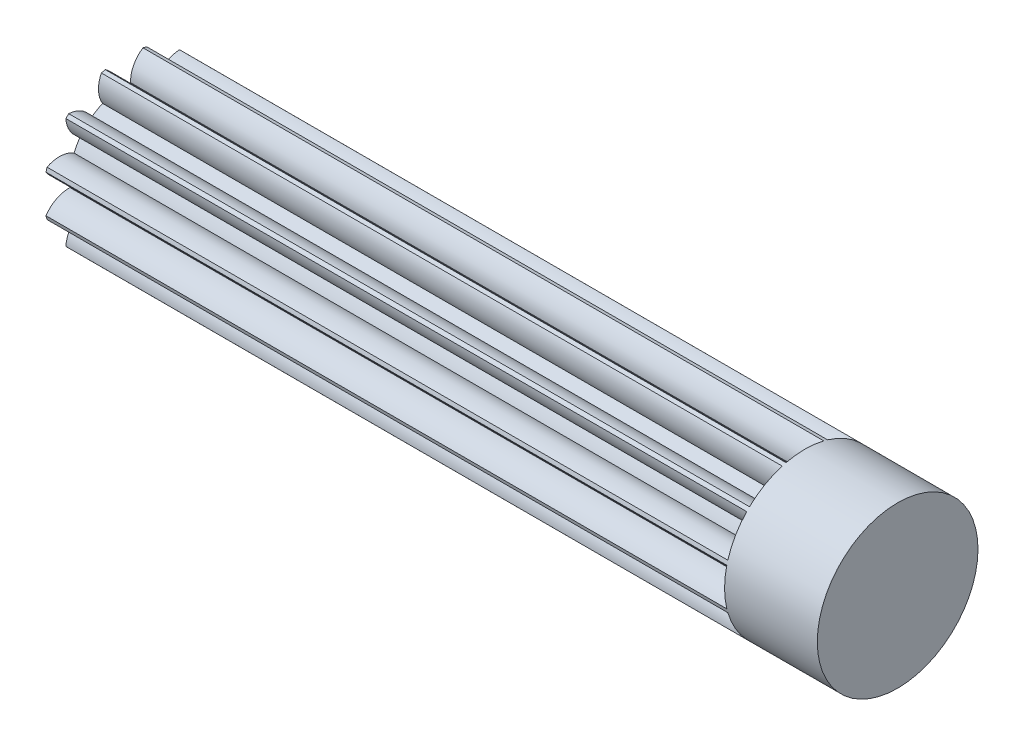
from build123d import *

# Parameters (mm, degrees)
BASPROSKE_W         = 59.315
BASPROSKE_H         = 7
TOOTHCUT_DEPTH      = 61.135424044
TEETHCUTS_COUNT     = 12
TEETHCUTS_ANGLE     = 330
BORSKE_R            = 0.4
BORE_DEPTH          = 50.0000508
SCALE1_SCALE        = 2
BOSS_EXTRUDE1_START = 16.163
SKETCH9_R           = 14
BOSS_EXTRUDE1_DEPTH = 16.163
SCALE2_SCALE        = 0.666666667
SKETCH10_R          = 5
CUT_EXTRUDE1_DEPTH  = 4
CUT_EXTRUDE3_DEPTH  = 20.25


with BuildPart() as part:
    # BasProSke → Base-Revolve (revolve)
    with BuildSketch(Plane(origin=(0, 0, 0), x_dir=(1, 0, 0), z_dir=(0, 1, 0)), mode=Mode.PRIVATE) as base_revolve_sk:
        with Locations((29.6575, 3.5)):
            Rectangle(BASPROSKE_W, BASPROSKE_H)
    revolve(base_revolve_sk.sketch.rotate(Axis((-10, 0, 0), (1, 0, 0)), 180), axis=Axis((-10, 0, 0), (1, 0, 0)))

    # TooCutSke → ToothCut (cut, through all)
    with BuildSketch(Plane(origin=(0, 0, 0), x_dir=(0, 0, -1), z_dir=(1, 0, 0))):
        with BuildLine():
            ThreePointArc((0.562207301, 4.715604304), (0, 4.749), (-0.562207301, 4.715604304))
            ThreePointArc((-0.562207301, 4.715604304), (-0.837528627, 5.917009812), (-1.672850686, 6.823328788))
            ThreePointArc((-1.672850686, 6.823328788), (0, 7.0254), (1.672850686, 6.823328788))
            ThreePointArc((1.672850686, 6.823328788), (0.837528627, 5.917009812), (0.562207301, 4.715604304))
        make_face()
    toothcut = extrude(amount=TOOTHCUT_DEPTH, mode=Mode.SUBTRACT)

    # TeethCuts: ToothCut ×12 about axis
    teethcuts_axis = Axis((-10, 0, 0), (1, 0, 0))
    for i in range(1, TEETHCUTS_COUNT):
        add(toothcut.rotate(teethcuts_axis, i * TEETHCUTS_ANGLE / (TEETHCUTS_COUNT - 1)), mode=Mode.SUBTRACT)

    # BorSke → Bore (cut, symmetric)
    with BuildSketch(Plane(origin=(0, 0, 0), x_dir=(0, 0, -1), z_dir=(1, 0, 0))):
        Circle(BORSKE_R)
    extrude(amount=BORE_DEPTH, both=True, mode=Mode.SUBTRACT)


with BuildPart() as part_1:
    # Scale1: scaled about (29.676274456, 0, 0)
    add(part.part.scale(SCALE1_SCALE).moved(Location((-29.676274456, 0, 0))))

    # Sketch9 → Boss-Extrude1 (add)
    with BuildSketch(Plane(origin=(88.953725544, 0, 0), x_dir=(0, 0, -1), z_dir=(1, 0, 0)).offset(BOSS_EXTRUDE1_START)):
        with Locations(Location((0, 0, 0), (0, 0, 166.421298953))):
            Circle(SKETCH9_R)
    extrude(amount=-BOSS_EXTRUDE1_DEPTH)


with BuildPart() as part_2:
    # Scale2: scaled about (40.880908015, 0, 0)
    add(part_1.part.scale(SCALE2_SCALE).moved(Location((13.626969338, 0, 0))))

    # Sketch10 → Cut-Extrude1 (cut)
    with BuildSketch(Plane.ZY.offset(6.157213633)):
        Circle(SKETCH10_R)
    extrude(amount=-CUT_EXTRUDE1_DEPTH, mode=Mode.SUBTRACT)

    # Sketch11 → Cut-Extrude3 (cut)
    with BuildSketch(Plane.ZY.offset(2.157213633)):
        with BuildLine():
            Line((4.5, 0), (4.5, 2.179449472))
            ThreePointArc((4.5, 2.179449472), (-5, 0), (4.5, -2.179449472))
            Line((4.5, -2.179449472), (4.5, 0))
        make_face()
    extrude(amount=-CUT_EXTRUDE3_DEPTH, mode=Mode.SUBTRACT)


solid = part_2.part
